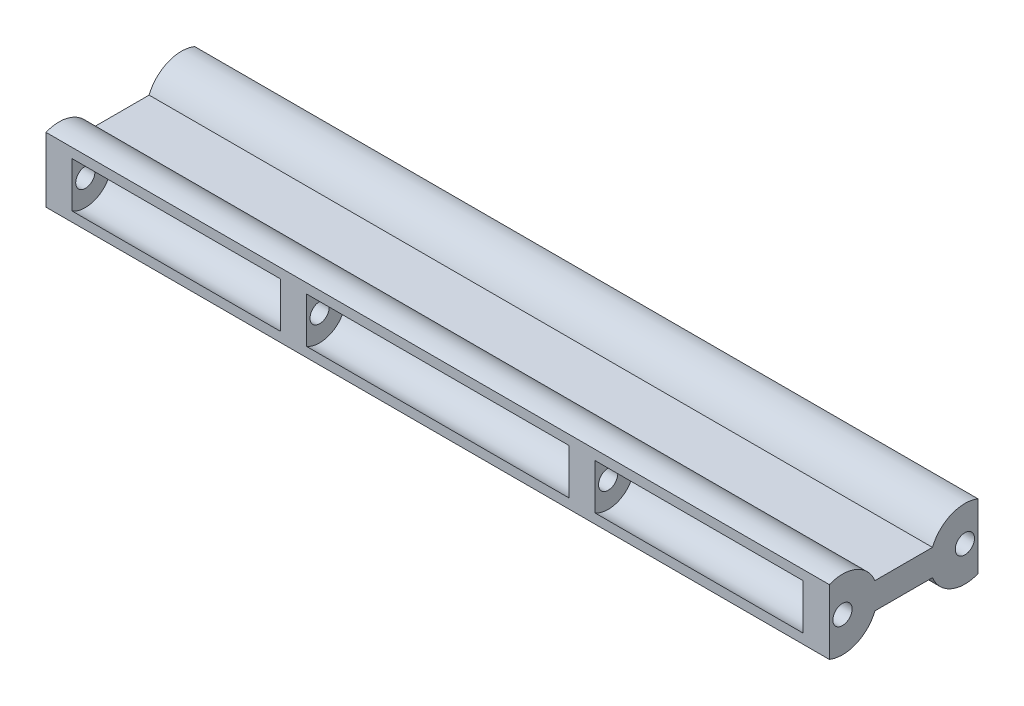
from build123d import *

# Parameters (mm, degrees)
EXTRUDE_1_DEPTH          = 15
EXTRUDE_1_2_DEPTH        = 15
EXTRUDE_START            = 44.8
EXTRUDE_2_DEPTH          = 29.8
EXTRUDE_START_2          = -15
EXTRUDE_3_DEPTH          = 29.8
CUT_EXTRUDE_START        = 41.8
CUT_EXTRUDE_1_DEPTH      = 23.8
CUT_EXTRUDE_START_2      = -18
CUT_EXTRUDE_2_DEPTH      = 23.8
CUT_EXTRUDE_3_DEPTH      = 46.774337789
CUT_EXTRUDE_3_DEPTH_BACK = 46.774337789
SKETCH_4_R               = 1.1


with BuildPart() as part:
    # 草图1 → 凸台-拉伸1 (new, symmetric)
    with BuildSketch(Plane(origin=(0, 0, 0), x_dir=(0, 0, -1), z_dir=(1, 0, 0))):
        with BuildLine():
            Line((-3.291900756, 1.5), (3.291900756, 1.5))
            ThreePointArc((3.291900756, 1.5), (5.438638051, 3.682682292), (8.5, 3.708099244))
            Line((8.5, 3.708099244), (8.5, 2.598076211))
            ThreePointArc((8.5, 2.598076211), (5.722521613, 2.714415033), (4.041960108, 0.5))
            Line((4.041960108, 0.5), (-4.041960108, 0.5))
            ThreePointArc((-4.041960108, 0.5), (-5.722521613, 2.714415033), (-8.5, 2.598076211))
            Line((-8.5, 2.598076211), (-8.5, 3.708099244))
            ThreePointArc((-8.5, 3.708099244), (-5.438638051, 3.682682292), (-3.291900756, 1.5))
        make_face()
    extrude(amount=EXTRUDE_1_DEPTH, both=True)



with BuildPart() as body_2:
    # 草图1 → Extrude 1 2 (new, symmetric)
    with BuildSketch(Plane(origin=(0, 0, 0), x_dir=(0, 0, -1), z_dir=(1, 0, 0))):
        with BuildLine():
            Line((-3.291900756, -1.5), (3.291900756, -1.5))
            ThreePointArc((3.291900756, -1.5), (5.438638051, -3.682682292), (8.5, -3.708099244))
            Line((8.5, -3.708099244), (8.5, -2.598076211))
            ThreePointArc((8.5, -2.598076211), (5.722521613, -2.714415033), (4.041960108, -0.5))
            Line((4.041960108, -0.5), (-4.041960108, -0.5))
            ThreePointArc((-4.041960108, -0.5), (-5.722521613, -2.714415033), (-8.5, -2.598076211))
            Line((-8.5, -2.598076211), (-8.5, -3.708099244))
            ThreePointArc((-8.5, -3.708099244), (-5.438638051, -3.682682292), (-3.291900756, -1.5))
        make_face()
    extrude(amount=EXTRUDE_1_2_DEPTH, both=True)


with BuildPart() as part_1:
    add(part.part)

    add(body_2.part)  # 凸台-拉伸2 merges body 2
    # 草图2 → 凸台-拉伸2 (add)
    with BuildSketch(Plane(origin=(0, 0, 0), x_dir=(0, 0, -1), z_dir=(1, 0, 0)).offset(EXTRUDE_START)):
        with BuildLine():
            Line((-3.291900756, -1.5), (3.291900756, -1.5))
            ThreePointArc((3.291900756, -1.5), (5.438638051, -3.682682292), (8.5, -3.708099244))
            Line((8.5, -3.708099244), (8.5, 3.708099244))
            ThreePointArc((8.5, 3.708099244), (5.438638051, 3.682682292), (3.291900756, 1.5))
            Line((3.291900756, 1.5), (-3.291900756, 1.5))
            ThreePointArc((-3.291900756, 1.5), (-5.438638051, 3.682682292), (-8.5, 3.708099244))
            Line((-8.5, 3.708099244), (-8.5, -3.708099244))
            ThreePointArc((-8.5, -3.708099244), (-5.438638051, -3.682682292), (-3.291900756, -1.5))
        make_face()
    extrude(amount=-EXTRUDE_2_DEPTH)

    # 草图2<2> → 凸台-拉伸3 (add)
    with BuildSketch(Plane(origin=(0, 0, 0), x_dir=(0, 0, -1), z_dir=(1, 0, 0)).offset(EXTRUDE_START_2)):
        with BuildLine():
            Line((-3.291900756, -1.5), (3.291900756, -1.5))
            ThreePointArc((3.291900756, -1.5), (5.438638051, -3.682682292), (8.5, -3.708099244))
            Line((8.5, -3.708099244), (8.5, 3.708099244))
            ThreePointArc((8.5, 3.708099244), (5.438638051, 3.682682292), (3.291900756, 1.5))
            Line((3.291900756, 1.5), (-3.291900756, 1.5))
            ThreePointArc((-3.291900756, 1.5), (-5.438638051, 3.682682292), (-8.5, 3.708099244))
            Line((-8.5, 3.708099244), (-8.5, -3.708099244))
            ThreePointArc((-8.5, -3.708099244), (-5.438638051, -3.682682292), (-3.291900756, -1.5))
        make_face()
    extrude(amount=-EXTRUDE_3_DEPTH)

    # 草图3 → 切除-拉伸1 (cut)
    with BuildSketch(Plane(origin=(0, 0, 0), x_dir=(0, 0, -1), z_dir=(1, 0, 0)).offset(CUT_EXTRUDE_START)):
        with BuildLine():
            Line((-4.041960108, 0.5), (-4.041960108, -0.5))
            ThreePointArc((-4.041960108, -0.5), (-5.722521613, -2.714415033), (-8.5, -2.598076211))
            Line((-8.5, -2.598076211), (-8.5, 2.598076211))
            ThreePointArc((-8.5, 2.598076211), (-5.722521613, 2.714415033), (-4.041960108, 0.5))
        make_face()
        with BuildLine():
            Line((8.5, 2.598076211), (8.5, -2.598076211))
            ThreePointArc((8.5, -2.598076211), (5.722521613, -2.714415033), (4.041960108, -0.5))
            Line((4.041960108, -0.5), (4.041960108, 0.5))
            ThreePointArc((4.041960108, 0.5), (5.722521613, 2.714415033), (8.5, 2.598076211))
        make_face()
    extrude(amount=-CUT_EXTRUDE_1_DEPTH, mode=Mode.SUBTRACT)

    # 草图3<2> → 切除-拉伸2 (cut)
    with BuildSketch(Plane(origin=(0, 0, 0), x_dir=(0, 0, -1), z_dir=(1, 0, 0)).offset(CUT_EXTRUDE_START_2)):
        with BuildLine():
            Line((-4.041960108, 0.5), (-4.041960108, -0.5))
            ThreePointArc((-4.041960108, -0.5), (-5.722521613, -2.714415033), (-8.5, -2.598076211))
            Line((-8.5, -2.598076211), (-8.5, 2.598076211))
            ThreePointArc((-8.5, 2.598076211), (-5.722521613, 2.714415033), (-4.041960108, 0.5))
        make_face()
        with BuildLine():
            Line((8.5, 2.598076211), (8.5, -2.598076211))
            ThreePointArc((8.5, -2.598076211), (5.722521613, -2.714415033), (4.041960108, -0.5))
            Line((4.041960108, -0.5), (4.041960108, 0.5))
            ThreePointArc((4.041960108, 0.5), (5.722521613, 2.714415033), (8.5, 2.598076211))
        make_face()
    extrude(amount=-CUT_EXTRUDE_2_DEPTH, mode=Mode.SUBTRACT)

    # 草图4 → 切除-拉伸3 (cut, two sides: drawn at the far end of the back side and taken through both)
    with BuildSketch(Plane(origin=(0, 0, 0), x_dir=(0, 0, -1), z_dir=(1, 0, 0)).offset(-CUT_EXTRUDE_3_DEPTH_BACK)):
        with Locations((-7, 0)):
            Circle(SKETCH_4_R)
        with Locations((7, 0)):
            Circle(SKETCH_4_R)
    extrude(amount=CUT_EXTRUDE_3_DEPTH + CUT_EXTRUDE_3_DEPTH_BACK, mode=Mode.SUBTRACT)


solid = part_1.part
